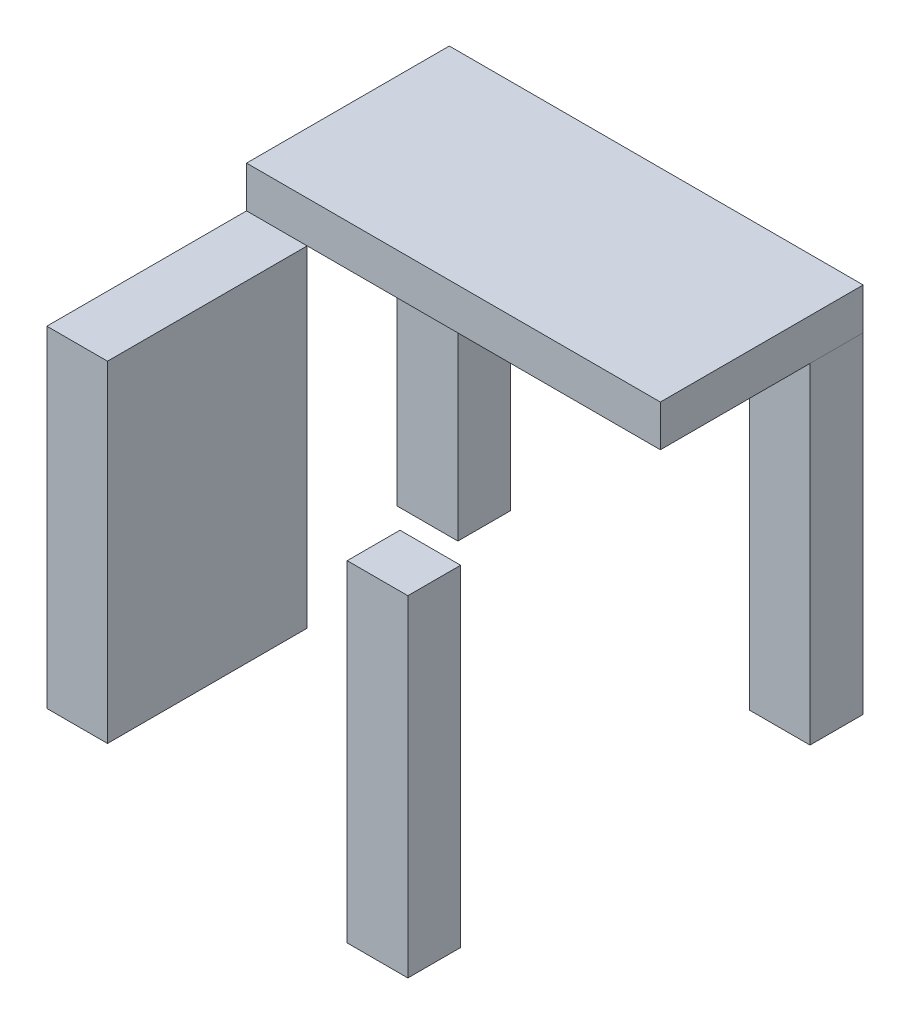
from build123d import *

# Parameters (mm, degrees)
SKETCH1_W           = 100
SKETCH1_H           = 10
BOSS_EXTRUDE1_DEPTH = 49
SKETCH2_W           = 14.657296337
SKETCH2_H           = 12.750406224
SKETCH2_H_2         = 48.249593776
SKETCH2_W_2         = 14.657296336
BOSS_EXTRUDE2_DEPTH = 80


with BuildPart() as part:
    # Sketch1 → Boss-Extrude1 (new body)
    with BuildSketch(Plane.XY):
        with Locations((50, 5)):
            Rectangle(SKETCH1_W, SKETCH1_H)
    extrude(amount=BOSS_EXTRUDE1_DEPTH)

    # Sketch2 → Boss-Extrude2 (add)
    with BuildSketch(Plane.XZ):
        with Locations((92.690459103, 103.659485129)):
            Rectangle(SKETCH2_W, SKETCH2_H)
        with Locations((7.328648169, 73.124796888)):
            Rectangle(SKETCH2_W, SKETCH2_H_2)
        with Locations((7.309540898, 6.193559762)):
            Rectangle(SKETCH2_W, SKETCH2_H)
        with Locations((92.543503994, 6.340514871)):
            Rectangle(SKETCH2_W_2, SKETCH2_H)
    extrude(amount=BOSS_EXTRUDE2_DEPTH)


with BuildPart() as boss_extrude2_piece_1:
    # of the separate pieces the step leaves, piece 1, a body of its own (boss_extrude2_pieces)
    add(part.part.solids().sort_by_distance((0, 0, 12.568762874))[0])


with BuildPart() as boss_extrude2_piece_2:
    # of the separate pieces the step leaves, piece 2, a body of its own (boss_extrude2_pieces)
    add(part.part.solids().sort_by_distance((0, -80, 49))[0])


with BuildPart() as boss_extrude2_piece_3:
    # of the separate pieces the step leaves, piece 3, a body of its own (boss_extrude2_pieces)
    add(part.part.solids().sort_by_distance((85.361810934, 0, 110.034688241))[0])


solid = Compound([boss_extrude2_piece_1.part, boss_extrude2_piece_2.part, boss_extrude2_piece_3.part])
